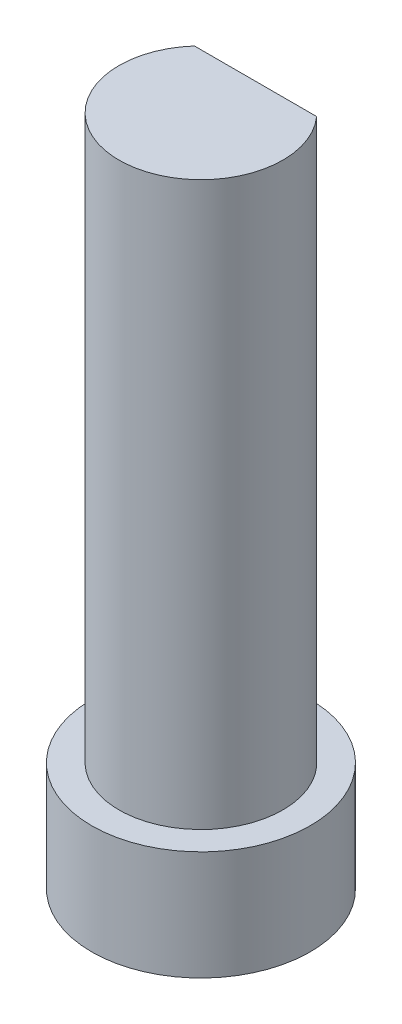
from build123d import *

# Parameters (mm, degrees)
CROQUIS1_R              = 2
SALIENTE_EXTRUIR1_DEPTH = 2
CROQUIS2_R              = 0.2
CORTAR_EXTRUIR1_DEPTH   = 2
CROQUIS3_R              = 1.5
SALIENTE_EXTRUIR2_DEPTH = 10.3
CORTAR_EXTRUIR2_DEPTH   = 10.3


with BuildPart() as part:
    # Croquis1 → Saliente-Extruir1 (new body)
    with BuildSketch(Plane(origin=(0, 0, 0), x_dir=(1, 0, 0), z_dir=(0, 1, 0))):
        with Locations(Location((0, 0, 0), (0, 0, 270))):
            Circle(CROQUIS1_R)
    extrude(amount=SALIENTE_EXTRUIR1_DEPTH)

    # Croquis2 → Cortar-Extruir1 (cut)
    with BuildSketch(Plane.XZ):
        with Locations(Location((0, 0, 0), (0, 0, 270))):
            Circle(CROQUIS2_R)
    extrude(amount=-CORTAR_EXTRUIR1_DEPTH, mode=Mode.SUBTRACT)


with BuildPart() as body_2:
    # Croquis3 → Saliente-Extruir2 (new body)
    with BuildSketch(Plane(origin=(0, 2, 0), x_dir=(1, 0, 0), z_dir=(0, 1, 0))):
        with Locations(Location((0, 0, 0), (0, 0, 90))):
            Circle(CROQUIS3_R)
    extrude(amount=SALIENTE_EXTRUIR2_DEPTH)

    # Croquis5 → Cortar-Extruir2 (cut)
    with BuildSketch(Plane(origin=(0, 12.3, 0), x_dir=(1, 0, 0), z_dir=(0, 1, 0))):
        with BuildLine():
            Line((0, 1), (1.118033989, 1))
            ThreePointArc((1.118033989, 1), (0, 1.5), (-1.118033989, 1))
            Line((-1.118033989, 1), (0, 1))
        make_face()
    extrude(amount=-CORTAR_EXTRUIR2_DEPTH, mode=Mode.SUBTRACT)


solid = Compound([part.part, body_2.part])
